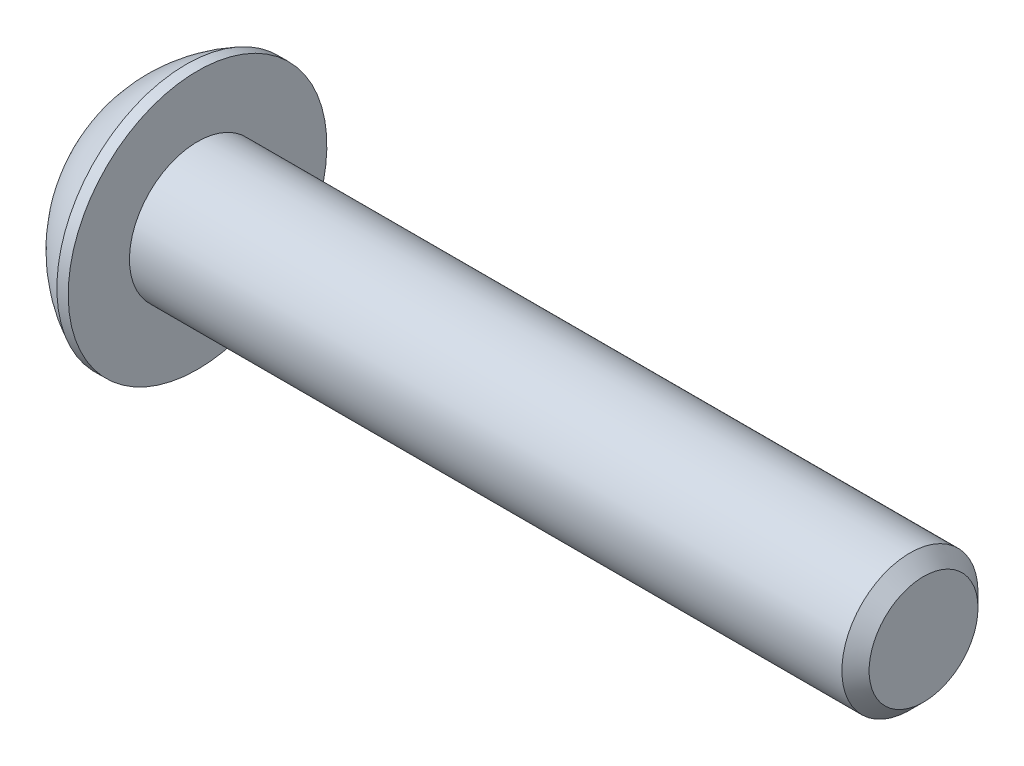
from build123d import *

# Parameters (mm, degrees)
SKETCH2_R           = 1.5
BOSS_EXTRUDE1_DEPTH = 16
CHAMFER1_SIZE       = 0.3
CUT_EXTRUDE1_DEPTH  = 1.2
SKETCH8_R           = 1.204700538
CUT_EXTRUDE2_DEPTH  = 1
CUT_EXTRUDE2_DRAFT  = -45


with BuildPart() as part:
    # Sketch2 → Boss-Extrude1 (new body)
    with BuildSketch(Plane(origin=(0, 0, 0), x_dir=(0, 0, -1), z_dir=(1, 0, 0))):
        Circle(SKETCH2_R)
    extrude(amount=-BOSS_EXTRUDE1_DEPTH)

    # Chamfer1
    chamfer1_edges = [part.edges().sort_by_distance(p)[0] for p in [
        (0, 0, 1.5),
    ]]
    chamfer(chamfer1_edges, length=CHAMFER1_SIZE)

    # Sketch6 → Revolve1 (revolve)
    with BuildSketch(Plane.XY):
        with BuildLine():
            Line((-17.65, 0), (-17.65, 1.5))
            ThreePointArc((-17.65, 1.5), (-17.055944823, 2.284868705), (-16.25, 2.85))
            Line((-16.25, 2.85), (-16, 2.85))
            Line((-16, 2.85), (-16, 0))
            Line((-16, 0), (-17.65, 0))
        make_face()
    revolve(axis=Axis((-16, 0, 0), (1, 0, 0)))

    # Sketch7 → Cut-Extrude1 (cut)
    with BuildSketch(Plane.ZY.offset(17.65)):
        Polygon((0, 1.154700538), (-1, 0.577350269), (-1, -0.577350269), (0, -1.154700538), (1, -0.577350269), (1, 0.577350269), align=None)
    extrude(amount=-CUT_EXTRUDE1_DEPTH, mode=Mode.SUBTRACT)


with BuildPart() as cut_extrude2_tool:
    # Sketch8 → Cut-Extrude2 (with draft: the straight prism first)
    with BuildSketch(Plane.ZY.offset(17.65)):
        Circle(SKETCH8_R)
    extrude(amount=-CUT_EXTRUDE2_DEPTH)
    # Cut-Extrude2: the draft: its side faces are tilted about the plane it starts from
    cut_extrude2_sides = [cut_extrude2_tool.faces().sort_by_distance(p)[0] for p in [
        (-17.15, 0, -1.204700538),
    ]]
    draft(cut_extrude2_sides, Plane.ZY.offset(17.65), CUT_EXTRUDE2_DRAFT)


with BuildPart() as part_1:
    add(part.part)

    # Cut-Extrude2: cut by cut_extrude2_tool
    add(cut_extrude2_tool.part, mode=Mode.SUBTRACT)


solid = part_1.part
